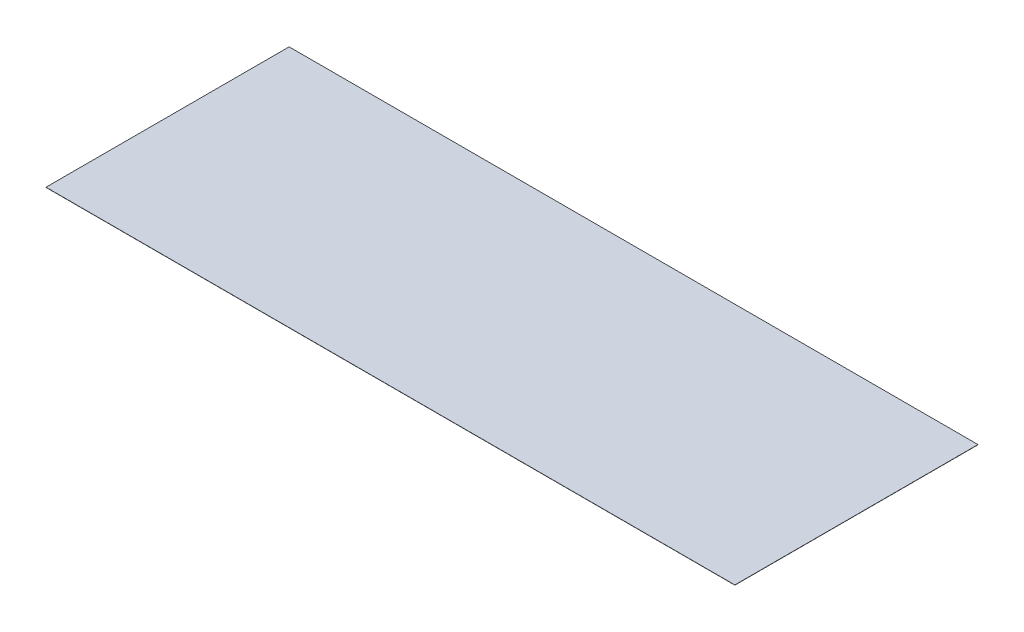
from build123d import *

# Parameters (mm, degrees)
SKETCH1_W           = 17000
SKETCH1_H           = 6000
BOSS_EXTRUDE1_DEPTH = 5


with BuildPart() as part:
    # Sketch1 → Boss-Extrude1 (new body)
    with BuildSketch(Plane(origin=(0, 0, 0), x_dir=(1, 0, 0), z_dir=(0, 1, 0))):
        Rectangle(SKETCH1_W, SKETCH1_H)
    extrude(amount=-BOSS_EXTRUDE1_DEPTH)


solid = part.part
